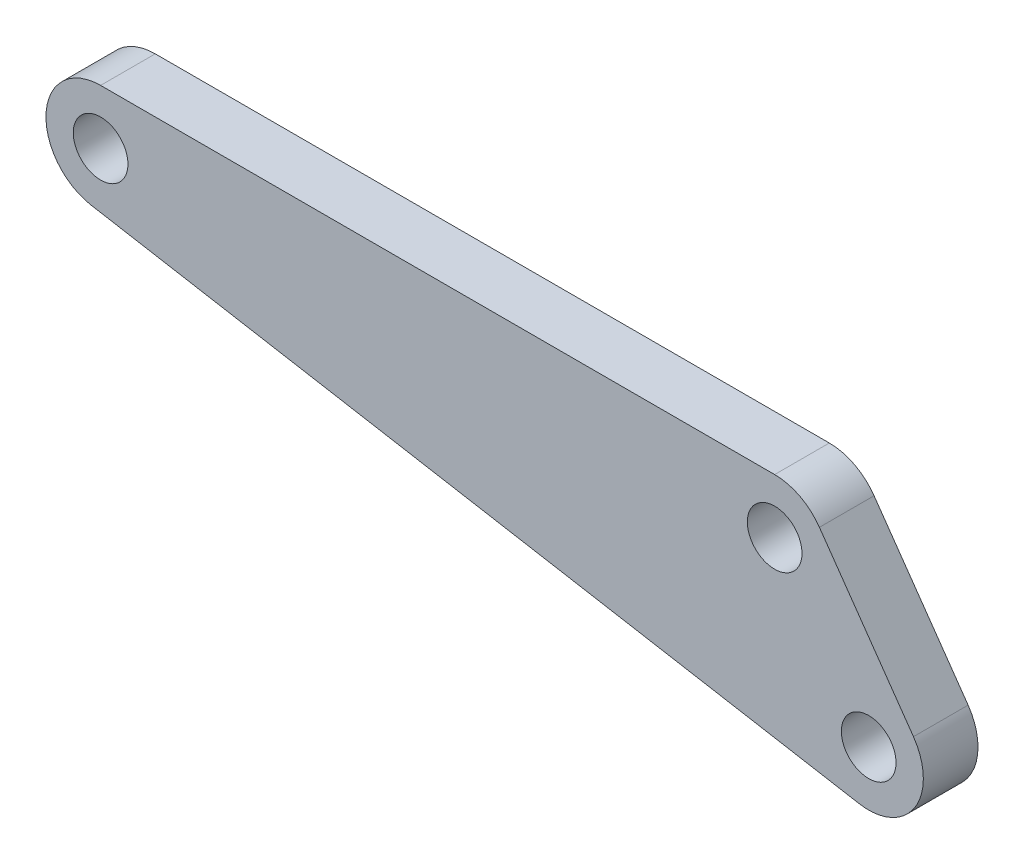
from build123d import *

# Parameters (mm, degrees)
SKETCH2_R           = 1.5
BOSS_EXTRUDE1_DEPTH = 3


with BuildPart() as part:
    # Sketch2 → Boss-Extrude1 (new body)
    with BuildSketch(Plane.XY):
        with BuildLine():
            Line((-37, 3), (0, 3))
            ThreePointArc((0, 3), (1.38524584, 2.6610325), (2.457456133, 1.720729309))
            Line((2.457456133, 1.720729309), (7.61964406, -5.65163909))
            ThreePointArc((7.61964406, -5.65163909), (7.693510643, -8.982463212), (4.645455968, -10.327531352))
            Line((4.645455968, -10.327531352), (-37.516731959, -2.955162954))
            ThreePointArc((-37.516731959, -2.955162954), (-39.988769719, 0.259336788), (-37, 3))
        make_face()
        with Locations((-37, 0)):
            Circle(SKETCH2_R, mode=Mode.SUBTRACT)
        Circle(SKETCH2_R, mode=Mode.SUBTRACT)
        with Locations((5.162187927, -7.372368399)):
            Circle(SKETCH2_R, mode=Mode.SUBTRACT)
    extrude(amount=BOSS_EXTRUDE1_DEPTH)


solid = part.part
